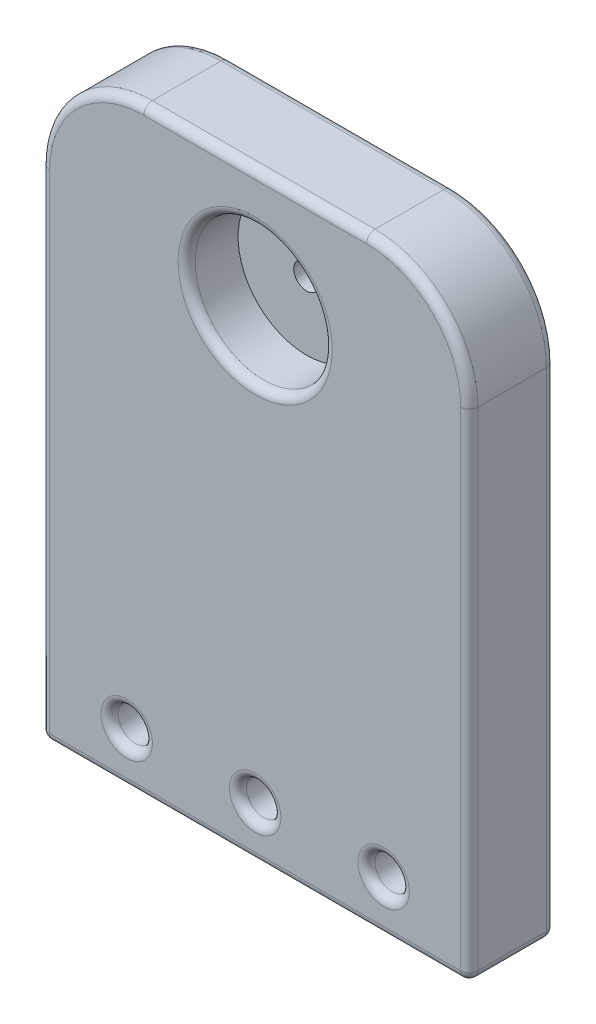
from build123d import *

# Parameters (mm, degrees)
SKETCH1_W           = 50
SKETCH1_H           = 70
BOSS_EXTRUDE1_DEPTH = 10
SKETCH6_R           = 1.5
CUT_EXTRUDE1_DEPTH  = 45.158804332
SKETCH8_R           = 8
CUT_EXTRUDE3_DEPTH  = 6
FILLET1_R           = 12
SKETCH9_R           = 2
CUT_EXTRUDE4_DEPTH  = 14
SKETCH10_R          = 3.875
CUT_EXTRUDE5_DEPTH  = 4
FILLET2_R           = 1


with BuildPart() as part:
    # Sketch1 → Boss-Extrude1 (new body)
    with BuildSketch(Plane.XY):
        Rectangle(SKETCH1_W, SKETCH1_H)
    extrude(amount=BOSS_EXTRUDE1_DEPTH)

    # Sketch6 → Cut-Extrude1 (cut, through all)
    with BuildSketch(Plane(origin=(0, 0, 0), x_dir=(-1, 0, 0), z_dir=(0, 0, -1))):
        with Locations((0, 21.25)):
            Circle(SKETCH6_R)
    extrude(amount=-CUT_EXTRUDE1_DEPTH, mode=Mode.SUBTRACT)

    # Sketch8 → Cut-Extrude3 (cut)
    with BuildSketch(Plane.XY.offset(10)):
        with Locations((0, 21.25)):
            Circle(SKETCH8_R)
    extrude(amount=-CUT_EXTRUDE3_DEPTH, mode=Mode.SUBTRACT)

    # Fillet1
    fillet1_edges = [part.edges().sort_by_distance(p)[0] for p in [
        (-25, 35, 5),
        (25, 35, 5),
    ]]
    fillet(fillet1_edges, radius=FILLET1_R)

    # Sketch9 → Cut-Extrude4 (cut)
    with BuildSketch(Plane(origin=(0, 0, 0), x_dir=(-1, 0, 0), z_dir=(0, 0, -1))):
        with Locations((-15, -29)):
            Circle(SKETCH9_R)
        with Locations((0, -29)):
            Circle(SKETCH9_R)
        with Locations((15, -29)):
            Circle(SKETCH9_R)
    extrude(amount=-CUT_EXTRUDE4_DEPTH, mode=Mode.SUBTRACT)

    # Sketch10 → Cut-Extrude5 (cut)
    with BuildSketch(Plane(origin=(0, 0, 0), x_dir=(-1, 0, 0), z_dir=(0, 0, -1))):
        with Locations((-15, -29)):
            Circle(SKETCH10_R)
        with Locations((0, -29)):
            Circle(SKETCH10_R)
        with Locations((15, -29)):
            Circle(SKETCH10_R)
    extrude(amount=-CUT_EXTRUDE5_DEPTH, mode=Mode.SUBTRACT)

    # Fillet2
    fillet2_edges = [part.edges().sort_by_distance(p)[0] for p in [
        (25, -6, 10),
        (1.5, 21.25, 0),
        (-8, 21.25, 10),
        (0, 35, 0),
        (0, 35, 10),
        (-25, -6, 0),
        (-21.485281374, 31.485281374, 0),
        (21.485281374, 31.485281374, 0),
        (-25, -6, 10),
        (-21.485281374, 31.485281374, 10),
        (21.485281374, 31.485281374, 10),
        (17, -29, 10),
        (2, -29, 10),
        (-13, -29, 10),
        (25, -6, 0),
        (0, -35, 0),
        (18.875, -29, 0),
        (3.875, -29, 0),
        (-11.125, -29, 0),
        (25, -35, 5),
        (-25, -35, 5),
        (0, -35, 10),
    ]]
    fillet(fillet2_edges, radius=FILLET2_R)


solid = part.part
